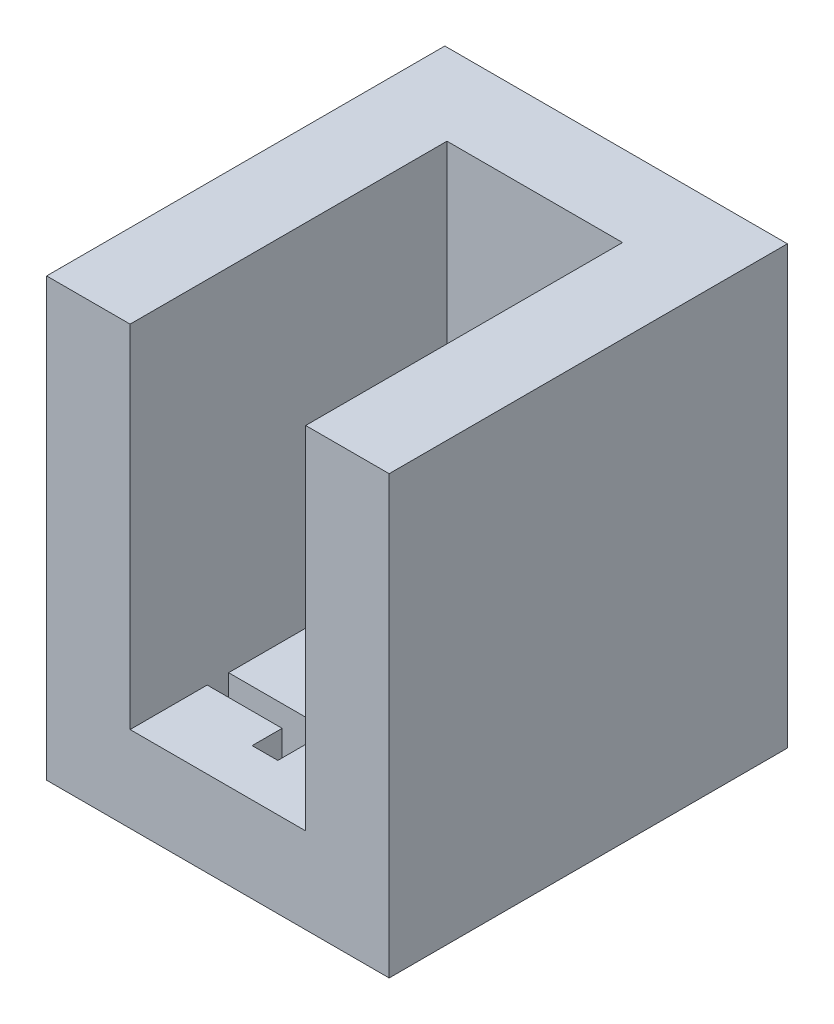
from build123d import *

# Parameters (mm, degrees)
SKETCH1_W           = 40
SKETCH1_H           = 46.5
BOSS_EXTRUDE1_DEPTH = 51
SKETCH2_W           = 20.5
SKETCH2_H           = 37
CUT_EXTRUDE1_DEPTH  = 41
CUT_EXTRUDE2_DEPTH  = 8.5


with BuildPart() as part:
    # Sketch1 → Boss-Extrude1 (new body)
    with BuildSketch(Plane(origin=(0, 0, 0), x_dir=(1, 0, 0), z_dir=(0, 1, 0))):
        Rectangle(SKETCH1_W, SKETCH1_H)
    extrude(amount=BOSS_EXTRUDE1_DEPTH)

    # Sketch2 → Cut-Extrude1 (cut)
    with BuildSketch(Plane(origin=(0, 51, 0), x_dir=(1, 0, 0), z_dir=(0, 1, 0))):
        with Locations((0, -4.75)):
            Rectangle(SKETCH2_W, SKETCH2_H)
    extrude(amount=-CUT_EXTRUDE1_DEPTH, mode=Mode.SUBTRACT)

    # Sketch3 → Cut-Extrude2 (cut)
    with BuildSketch(Plane(origin=(0, 10, 0), x_dir=(1, 0, 0), z_dir=(0, 1, 0))):
        Polygon((-10.25, -11.75), (10.25, -11.75), (10.25, -14.25), (1.5, -14.25), (1.5, -17.75), (-1.5, -17.75), (-1.5, -14.25), (-10.25, -14.25), align=None)
    extrude(amount=-CUT_EXTRUDE2_DEPTH, mode=Mode.SUBTRACT)


solid = part.part
